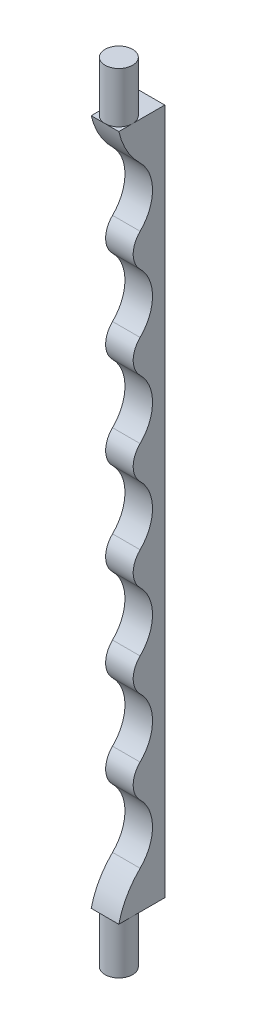
from build123d import *

# Parameters (mm, degrees)
BOSS_EXTRUDE1_DEPTH = 9
SKETCH2_R           = 4.5
BOSS_EXTRUDE2_DEPTH = 16.5


with BuildPart() as part:
    # Sketch1 → Boss-Extrude1 (new body)
    with BuildSketch(Plane.YZ):
        with BuildLine():
            Line((-112, -2.5), (-112, -17.5))
            Line((-112, -17.5), (112, -17.5))
            Line((112, -17.5), (112, -2.5))
            ThreePointArc((112, -2.5), (105.325857912, -5.092638652), (99.642857143, -9.448031865))
            ThreePointArc((99.642857143, -9.448031865), (90, -13.5), (80.357142857, -9.448031865))
            ThreePointArc((80.357142857, -9.448031865), (75, -7.196938457), (69.642857143, -9.448031865))
            ThreePointArc((69.642857143, -9.448031865), (60, -13.5), (50.357142857, -9.448031865))
            ThreePointArc((50.357142857, -9.448031865), (45, -7.196938457), (39.642857143, -9.448031865))
            ThreePointArc((39.642857143, -9.448031865), (30, -13.5), (20.357142857, -9.448031865))
            ThreePointArc((20.357142857, -9.448031865), (15, -7.196938457), (9.642857143, -9.448031865))
            ThreePointArc((9.642857143, -9.448031865), (0, -13.5), (-9.642857143, -9.448031865))
            ThreePointArc((-9.642857143, -9.448031865), (-15, -7.196938457), (-20.357142857, -9.448031865))
            ThreePointArc((-20.357142857, -9.448031865), (-30, -13.5), (-39.642857143, -9.448031865))
            ThreePointArc((-39.642857143, -9.448031865), (-45, -7.196938457), (-50.357142857, -9.448031865))
            ThreePointArc((-50.357142857, -9.448031865), (-60, -13.5), (-69.642857143, -9.448031865))
            ThreePointArc((-69.642857143, -9.448031865), (-75, -7.196938457), (-80.357142857, -9.448031865))
            ThreePointArc((-80.357142857, -9.448031865), (-90, -13.5), (-99.642857143, -9.448031865))
            ThreePointArc((-99.642857143, -9.448031865), (-105.325857912, -5.092638652), (-112, -2.5))
        make_face()
    extrude(amount=BOSS_EXTRUDE1_DEPTH)

    # Sketch2 → Boss-Extrude2 (add)
    with BuildSketch(Plane.XZ.offset(112)):
        with Locations(Location((4.5, -7, 0), (0, 0, 90))):
            Circle(SKETCH2_R)
    boss_extrude2 = extrude(amount=BOSS_EXTRUDE2_DEPTH)

    # Mirror1: Boss-Extrude2 across plane
    add(boss_extrude2.mirror(Plane.ZX))


solid = part.part
